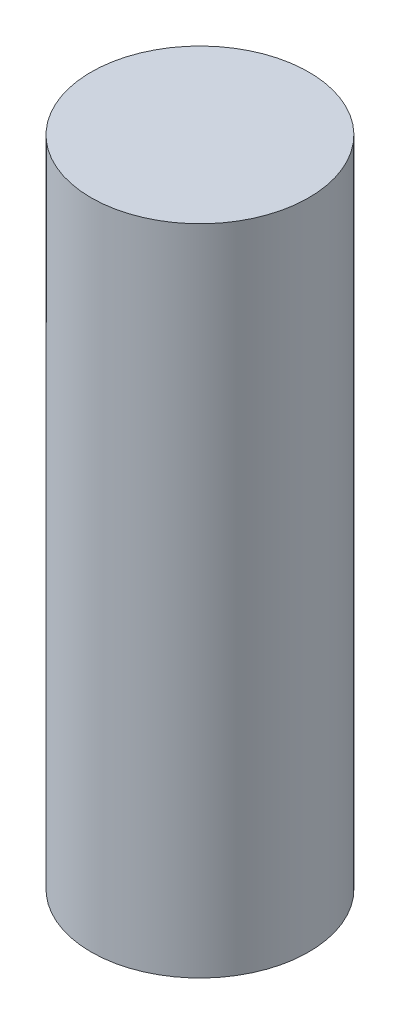
from build123d import *

# Parameters (mm, degrees)
SKETCH1_R           = 50
BOSS_EXTRUDE1_DEPTH = 300


with BuildPart() as part:
    # Sketch1 → Boss-Extrude1 (new body)
    with BuildSketch(Plane(origin=(0, 0, 0), x_dir=(1, 0, 0), z_dir=(0, 1, 0))):
        with Locations(Location((0, 0, 0), (0, 0, 270))):
            Circle(SKETCH1_R)
    extrude(amount=BOSS_EXTRUDE1_DEPTH)


solid = part.part
